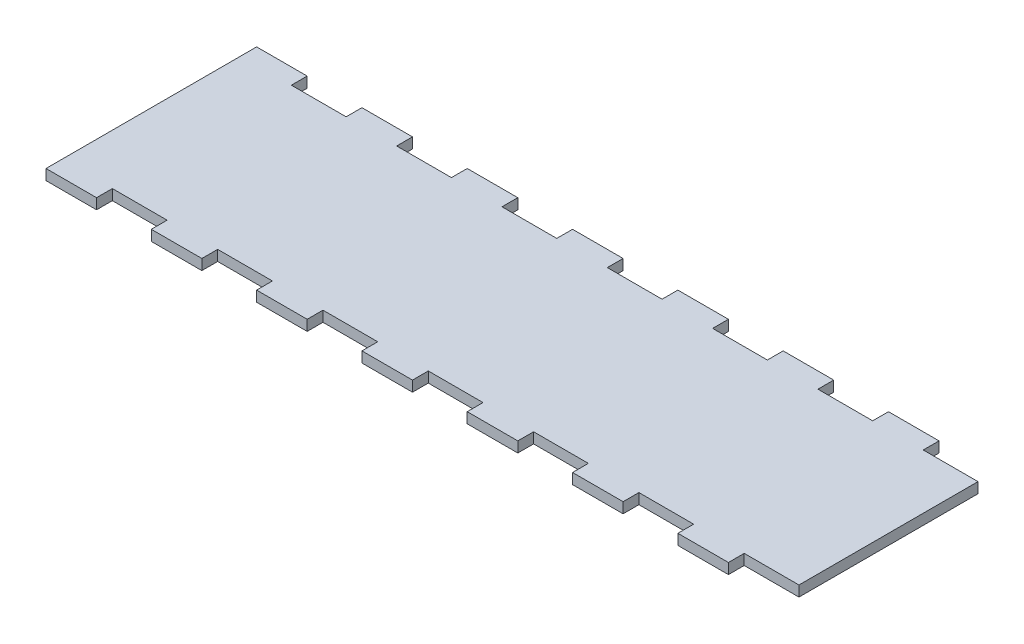
from build123d import *

# Parameters (mm, degrees)
SKETCH1_W           = 177.8
SKETCH1_H           = 43.18
BOSS_EXTRUDE1_DEPTH = 2.54
SKETCH2_W           = 12.192
SKETCH2_H           = 3.81
BOSS_EXTRUDE2_DEPTH = 2.54


with BuildPart() as part:
    # Sketch1 → Boss-Extrude1 (new body)
    with BuildSketch(Plane(origin=(0, 0, 0), x_dir=(1, 0, 0), z_dir=(0, 1, 0))):
        Rectangle(SKETCH1_W, SKETCH1_H)
    extrude(amount=BOSS_EXTRUDE1_DEPTH)

    # Sketch2 → Boss-Extrude2 (add)
    with BuildSketch(Plane(origin=(0, 0, 0), x_dir=(1, 0, 0), z_dir=(0, 1, 0))):
        with Locations((-57.404, 23.495)):
            Rectangle(SKETCH2_W, SKETCH2_H)
        with Locations((-82.804, 23.495)):
            Rectangle(SKETCH2_W, SKETCH2_H)
        with Locations((-32.004, 23.495)):
            Rectangle(SKETCH2_W, SKETCH2_H)
        with Locations((-6.604, 23.495)):
            Rectangle(SKETCH2_W, SKETCH2_H)
        with Locations((18.796, 23.495)):
            Rectangle(SKETCH2_W, SKETCH2_H)
        with Locations((44.196, 23.495)):
            Rectangle(SKETCH2_W, SKETCH2_H)
        with Locations((69.596, 23.495)):
            Rectangle(SKETCH2_W, SKETCH2_H)
    boss_extrude2 = extrude(amount=BOSS_EXTRUDE2_DEPTH)

    # Mirror1: Boss-Extrude2 across plane
    add(boss_extrude2.mirror(Plane.XY))


solid = part.part
